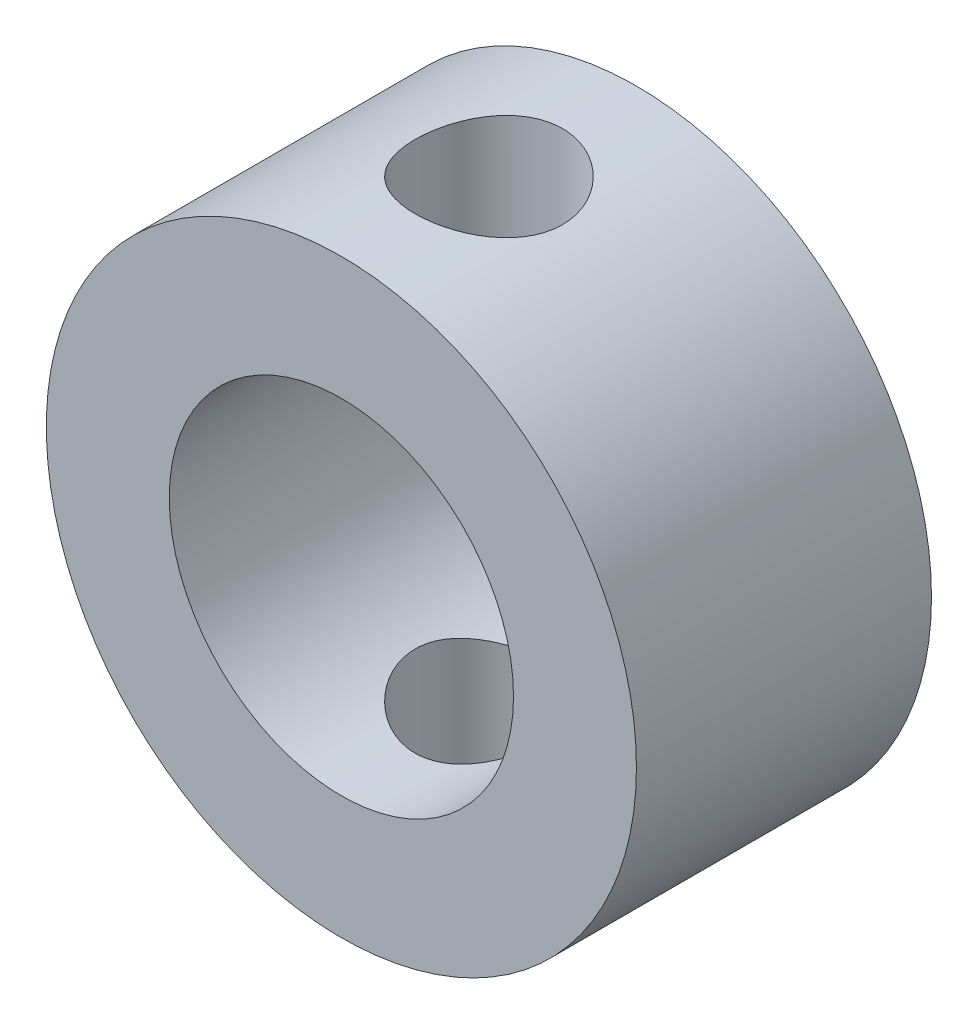
from build123d import *

# Parameters (mm, degrees)
SKETCH1_R               = 12
SKETCH1_R_2             = 7
BOSS_EXTRUDE1_DEPTH     = 12
CUT_EXTRUDE1_DEPTH      = 21.784609691
CUT_EXTRUDE1_DEPTH_BACK = 21.784609691
SKETCH2_R               = 3


with BuildPart() as part:
    # Sketch1 → Boss-Extrude1 (new body)
    with BuildSketch(Plane.XY):
        Circle(SKETCH1_R)
        Circle(SKETCH1_R_2, mode=Mode.SUBTRACT)
    extrude(amount=BOSS_EXTRUDE1_DEPTH)

    # Sketch2 → Cut-Extrude1 (cut, two sides: drawn at the far end of the back side and taken through both)
    with BuildSketch(Plane(origin=(0, 0, 0), x_dir=(1, 0, 0), z_dir=(0, 1, 0)).offset(-CUT_EXTRUDE1_DEPTH_BACK)):
        with Locations(Location((0, -6, 0), (0, 0, 270))):
            Circle(SKETCH2_R)
    extrude(amount=CUT_EXTRUDE1_DEPTH + CUT_EXTRUDE1_DEPTH_BACK, mode=Mode.SUBTRACT)


solid = part.part
